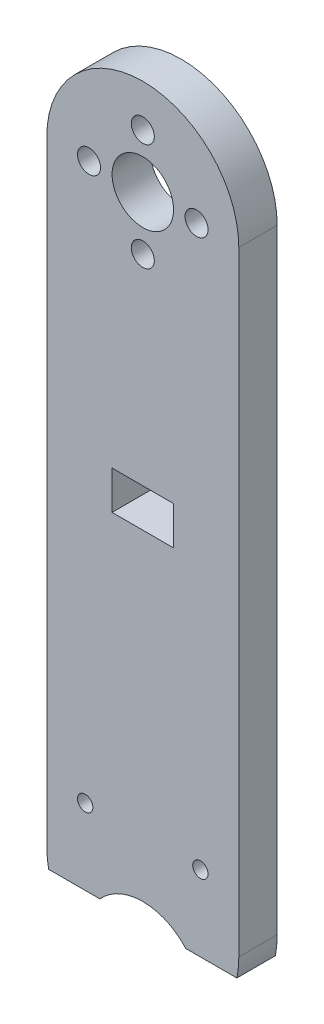
from build123d import *

# Parameters (mm, degrees)
SKETCH1_R           = 1
SKETCH1_R_2         = 1.5
SKETCH1_R_3         = 4
BOSS_EXTRUDE2_DEPTH = 5
SKETCH2_W           = 8
SKETCH2_H           = 5
CUT_EXTRUDE1_DEPTH  = 10


with BuildPart() as part:
    # Sketch1 → Boss-Extrude2 (new body)
    with BuildSketch(Plane.XY):
        with BuildLine():
            Line((-12.5, 40), (-12.5, -40))
            ThreePointArc((-12.5, -40), (-12.436701913, -41.256362025), (-12.247448714, -42.5))
            Line((-12.247448714, -42.5), (-5.590169944, -42.5))
            ThreePointArc((-5.590169944, -42.5), (0, -40), (5.590169944, -42.5))
            Line((5.590169944, -42.5), (12.247448714, -42.5))
            ThreePointArc((12.247448714, -42.5), (12.436701913, -41.256362025), (12.5, -40))
            Line((12.5, -40), (12.5, 40))
            ThreePointArc((12.5, 40), (0, 52.5), (-12.5, 40))
        make_face()
        with Locations((-7.5, -32.65)):
            Circle(SKETCH1_R, mode=Mode.SUBTRACT)
        with Locations((7.5, -32.65)):
            Circle(SKETCH1_R, mode=Mode.SUBTRACT)
        with Locations((-7, 40)):
            Circle(SKETCH1_R_2, mode=Mode.SUBTRACT)
        with Locations((0, 40)):
            Circle(SKETCH1_R_3, mode=Mode.SUBTRACT)
        with Locations((0, 33)):
            Circle(SKETCH1_R_2, mode=Mode.SUBTRACT)
        with Locations((0, 47)):
            Circle(SKETCH1_R_2, mode=Mode.SUBTRACT)
        with Locations((7, 40)):
            Circle(SKETCH1_R_2, mode=Mode.SUBTRACT)
    extrude(amount=BOSS_EXTRUDE2_DEPTH)

    # Sketch2 → Cut-Extrude1 (cut)
    with BuildSketch(Plane.XY.offset(6)):
        with Locations((0, 4.38)):
            Rectangle(SKETCH2_W, SKETCH2_H)
    extrude(amount=-CUT_EXTRUDE1_DEPTH, mode=Mode.SUBTRACT)


solid = part.part
